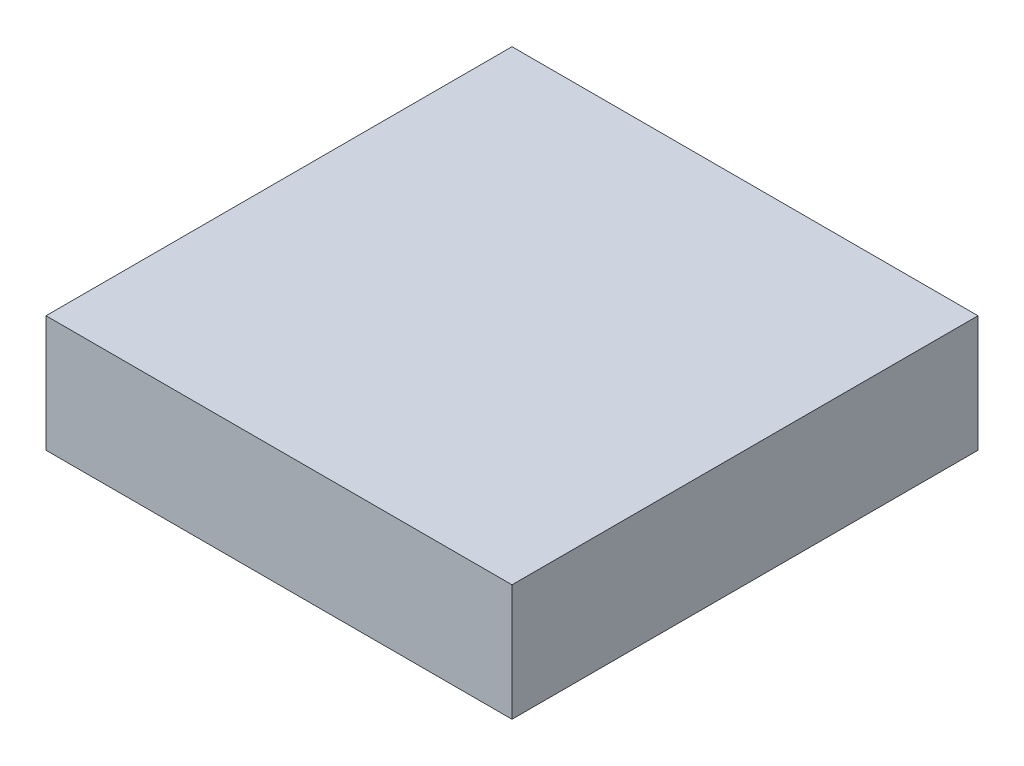
from build123d import *

# Parameters (mm, degrees)
SKETCH1_W           = 60
SKETCH1_H           = 60
BOSS_EXTRUDE1_DEPTH = 15


with BuildPart() as part:
    # Sketch1 → Boss-Extrude1 (new body)
    with BuildSketch(Plane(origin=(0, 0, 0), x_dir=(1, 0, 0), z_dir=(0, 1, 0))):
        with Locations((30, 30)):
            Rectangle(SKETCH1_W, SKETCH1_H)
    extrude(amount=BOSS_EXTRUDE1_DEPTH)


solid = part.part
